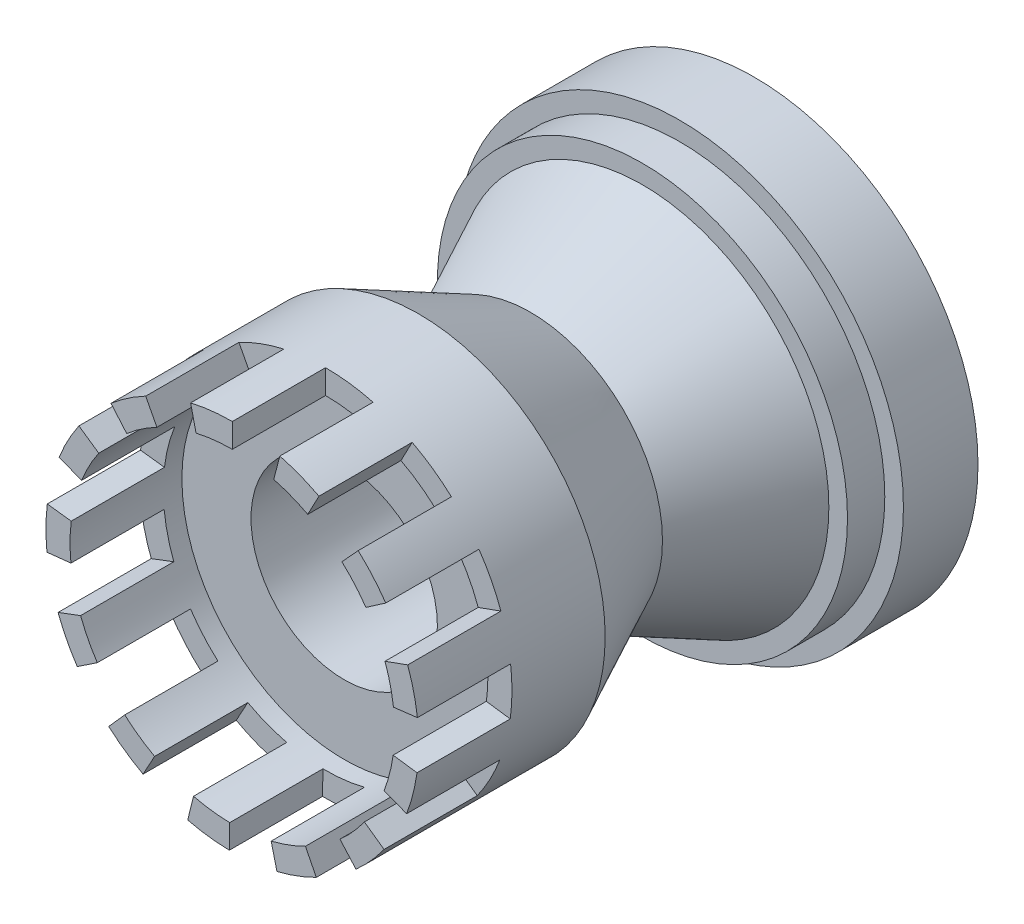
from build123d import *

# Parameters (mm, degrees)
SKETCH_1_R          = 6
EXTRUDE_1_DEPTH     = 2
SKETCH_2_R          = 5.5
EXTRUDE_2_DEPTH     = 1
SKETCH_3_R          = 5
EXTRUDE_3_DEPTH     = 3
EXTRUDE_3_TAPER     = 26
SKETCH_4_R          = 3.536802234
EXTRUDE_4_DEPTH     = 3
EXTRUDE_4_DRAFT     = -26
SKETCH_5_R          = 5
EXTRUDE_5_DEPTH     = 5
SKETCH_6_R          = 4.35308232
CUT_EXTRUDE_1_DEPTH = 3
CUT_EXTRUDE_2_DEPTH = 2.5
SKETCH_8_R          = 2.5
CUT_EXTRUDE_3_DEPTH = 14.892443989


with BuildPart() as part:
    # 스케치1 → 보스-돌출1 (new body)
    with BuildSketch(Plane.XY):
        Circle(SKETCH_1_R)
    extrude(amount=EXTRUDE_1_DEPTH)

    # 스케치2 → 보스-돌출2 (add)
    with BuildSketch(Plane.XY.offset(2)):
        Circle(SKETCH_2_R)
    extrude(amount=EXTRUDE_2_DEPTH)

    # 스케치3 → 보스-돌출3 (add)
    with BuildSketch(Plane.XY.offset(3)):
        Circle(SKETCH_3_R)
    extrude(amount=EXTRUDE_3_DEPTH, taper=EXTRUDE_3_TAPER)


with BuildPart() as extrude_4_tool:
    # 스케치4 → 보스-돌출4 (with draft: the straight prism first)
    with BuildSketch(Plane.XY.offset(6)):
        Circle(SKETCH_4_R)
    extrude(amount=EXTRUDE_4_DEPTH)
    # 보스-돌출4: the draft: its side faces are tilted about the plane it starts from
    extrude_4_sides = [extrude_4_tool.faces().sort_by_distance(p)[0] for p in [
        (-3.536802234, 0, 7.5),
    ]]
    draft(extrude_4_sides, Plane.XY.offset(6), EXTRUDE_4_DRAFT)


with BuildPart() as part_1:
    add(part.part)

    # 보스-돌출4: add extrude_4_tool
    add(extrude_4_tool.part)

    # 스케치5 → 보스-돌출5 (add)
    with BuildSketch(Plane.XY.offset(9)):
        Circle(SKETCH_5_R)
    extrude(amount=EXTRUDE_5_DEPTH)

    # 스케치6 → 컷-돌출1 (cut)
    with BuildSketch(Plane.XY.offset(14)):
        Circle(SKETCH_6_R)
    extrude(amount=-CUT_EXTRUDE_1_DEPTH, mode=Mode.SUBTRACT)

    # 스케치7 → 컷-돌출2 (cut)
    with BuildSketch(Plane.XY.offset(14)):
        with BuildLine():
            Line((0, 4.35308232), (0, 5))
            ThreePointArc((0, 5), (0.642664488, 4.958526228), (1.274667489, 4.834792942))
            Line((1.274667489, 4.834792942), (1.109746502, 4.209250336))
            ThreePointArc((1.109746502, 4.209250336), (0.559514284, 4.316974572), (0, 4.35308232))
        make_face()
        with BuildLine():
            Line((2.022978224, 3.854462971), (2.32361586, 4.427280128))
            ThreePointArc((2.32361586, 4.427280128), (2.873393181, 4.091895847), (3.375502321, 3.688629025))
            Line((3.375502321, 3.688629025), (2.938767895, 3.211381159))
            ThreePointArc((2.938767895, 3.211381159), (2.501623411, 3.562471894), (2.022978224, 3.854462971))
        make_face()
        with BuildLine():
            Line((3.582516517, 2.472832606), (4.114919329, 2.840323734))
            ThreePointArc((4.114919329, 2.840323734), (4.445862124, 2.287861441), (4.70305025, 1.697444651))
            Line((4.70305025, 1.697444651), (4.094552979, 1.47782326))
            ThreePointArc((4.094552979, 1.47782326), (3.870640762, 1.991849838), (3.582516517, 2.472832606))
        make_face()
        with BuildLine():
            Line((4.321343449, 0.524706092), (4.96354437, 0.602683401))
            ThreePointArc((4.96354437, 0.602683401), (4.999837633, -0.04029445), (4.953186046, -0.682603837))
            Line((4.953186046, -0.682603837), (4.312325321, -0.594286139))
            ThreePointArc((4.312325321, -0.594286139), (4.352940961, -0.035081012), (4.321343449, 0.524706092))
        make_face()
        with BuildLine():
            Line((4.070202675, -1.543624265), (4.675081213, -1.773024435))
            ThreePointArc((4.675081213, -1.773024435), (4.408410595, -2.359219368), (4.06860661, -2.906276011))
            Line((4.06860661, -2.906276011), (3.542195901, -2.530251744))
            ThreePointArc((3.542195901, -2.530251744), (3.838034844, -2.053975224), (4.070202675, -1.543624265))
        make_face()
        with BuildLine():
            Line((2.88662752, -3.258328904), (3.315613291, -3.742553741))
            ThreePointArc((3.315613291, -3.742553741), (2.807069816, -4.137675561), (2.251958432, -4.464155376))
            Line((2.251958432, -4.464155376), (1.960592088, -3.886567168))
            ThreePointArc((1.960592088, -3.886567168), (2.443881198, -3.602328466), (2.88662752, -3.258328904))
        make_face()
        with BuildLine():
            Line((1.041760787, -4.22658966), (1.196578321, -4.854709087))
            ThreePointArc((1.196578321, -4.854709087), (0.562663172, -4.968240147), (-0.080586283, -4.999350543))
            Line((-0.080586283, -4.999350543), (-0.070159745, -4.352516892))
            ThreePointArc((-0.070159745, -4.352516892), (0.489863821, -4.325431669), (1.041760787, -4.22658966))
        make_face()
        with BuildLine():
            Line((-1.041760787, -4.22658966), (-1.196578321, -4.854709087))
            ThreePointArc((-1.196578321, -4.854709087), (-1.810642825, -4.660640789), (-2.394669653, -4.389254749))
            Line((-2.394669653, -4.389254749), (-2.084838826, -3.82135745))
            ThreePointArc((-2.084838826, -3.82135745), (-1.576375454, -4.057630604), (-1.041760787, -4.22658966))
        make_face()
        with BuildLine():
            Line((-2.88662752, -3.258328904), (-3.315613291, -3.742553741))
            ThreePointArc((-3.315613291, -3.742553741), (-3.76915237, -3.285344793), (-4.160163063, -2.773633589))
            Line((-4.160163063, -2.773633589), (-3.621906456, -2.414771068))
            ThreePointArc((-3.621906456, -2.414771068), (-3.281486109, -2.860275267), (-2.88662752, -3.258328904))
        make_face()
        with BuildLine():
            Line((-4.070202675, -1.543624265), (-4.675081213, -1.773024435))
            ThreePointArc((-4.675081213, -1.773024435), (-4.864194531, -1.157415898), (-4.972613252, -0.522606399))
            Line((-4.972613252, -0.522606399), (-4.329238966, -0.454989735))
            ThreePointArc((-4.329238966, -0.454989735), (-4.234847844, -1.007665336), (-4.070202675, -1.543624265))
        make_face()
        with BuildLine():
            Line((-4.321343449, 0.524706092), (-4.96354437, 0.602683401))
            ThreePointArc((-4.96354437, 0.602683401), (-4.844908345, 1.235663031), (-4.645897671, 1.848143618))
            Line((-4.645897671, 1.848143618), (-4.044795002, 1.609024262))
            ThreePointArc((-4.044795002, 1.609024262), (-4.218056972, 1.075788579), (-4.321343449, 0.524706092))
        make_face()
        with BuildLine():
            Line((-3.582516517, 2.472832606), (-4.114919329, 2.840323734))
            ThreePointArc((-4.114919329, 2.840323734), (-3.715712045, 3.345666451), (-3.254862922, 3.795506206))
            Line((-3.254862922, 3.795506206), (-2.833737248, 3.304430192))
            ThreePointArc((-2.833737248, 3.304430192), (-3.234960082, 2.912792296), (-3.582516517, 2.472832606))
        make_face()
        with BuildLine():
            Line((-2.022978224, 3.854462971), (-2.32361586, 4.427280128))
            ThreePointArc((-2.32361586, 4.427280128), (-1.735290894, 4.689218007), (-1.118178304, 4.873364062))
            Line((-1.118178304, 4.873364062), (-0.973504441, 4.242830988))
            ThreePointArc((-0.973504441, 4.242830988), (-1.510772822, 4.0825104), (-2.022978224, 3.854462971))
        make_face()
    extrude(amount=-CUT_EXTRUDE_2_DEPTH, mode=Mode.SUBTRACT)

    # 스케치8 → 컷-돌출3 (cut, through all)
    with BuildSketch(Plane.XY.offset(11)):
        Circle(SKETCH_8_R)
    extrude(amount=-CUT_EXTRUDE_3_DEPTH, mode=Mode.SUBTRACT)


solid = part_1.part
